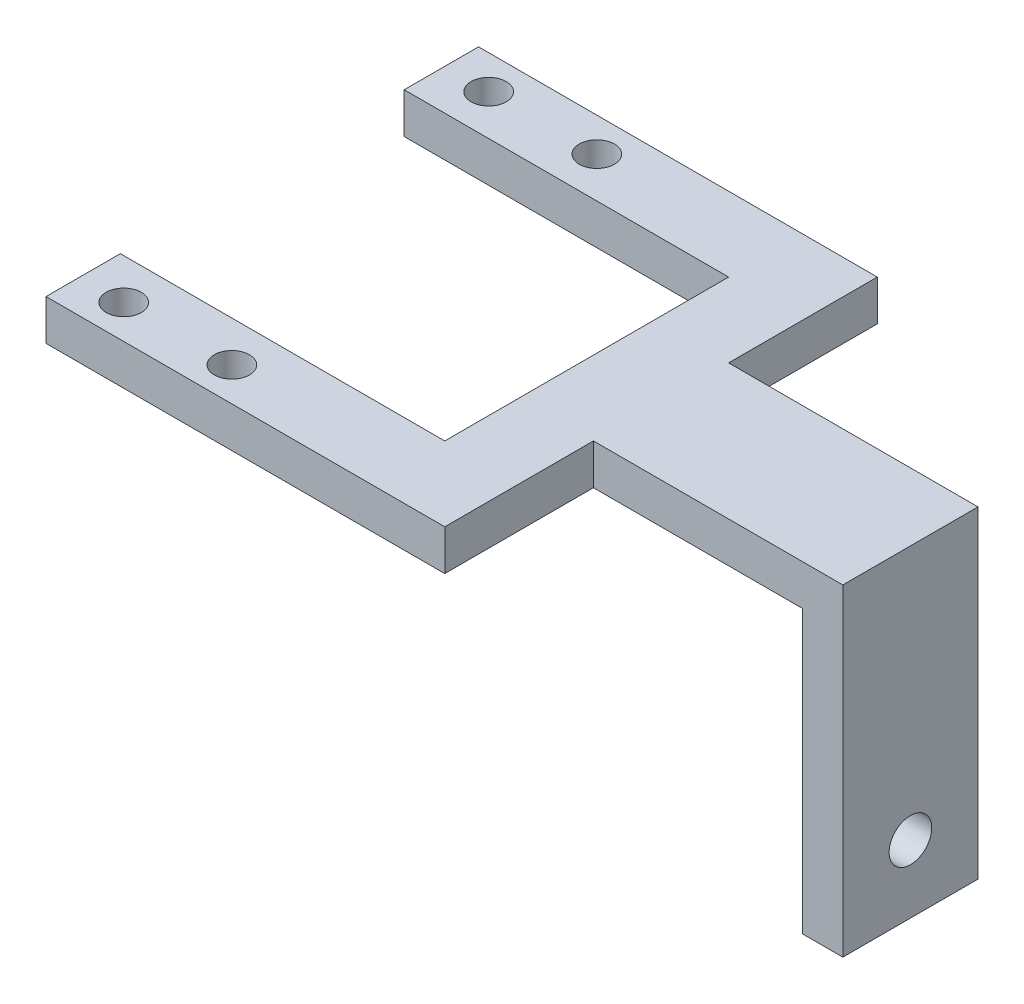
from build123d import *

# Parameters (mm, degrees)
SKETCH1_R           = 1.3
SKETCH1_W           = 3
SKETCH1_H           = 10
BOSS_EXTRUDE2_DEPTH = 3
SKETCH1_5_W         = 3
SKETCH1_5_H         = 10
BOSS_EXTRUDE3_DEPTH = 23.85
SKETCH4_R           = 1.575411087
CUT_EXTRUDE1_DEPTH  = 3


with BuildPart() as part:
    # Sketch1 → Boss-Extrude2 (new body)
    # profile 1 of 2: a face of its own
    with BuildSketch(Plane(origin=(0, 0, 0), x_dir=(1, 0, 0), z_dir=(0, 1, 0))):
        Polygon((-14.75, 16), (-14.75, 10.5), (9.25, 10.5), (9.25, -10.5), (-14.75, -10.5), (-14.75, -16), (14.75, -16), (14.75, -5), (30.2, -5), (30.2, 5), (14.75, 5), (14.75, 16), align=None)
        with Locations(Location((-11.5, -13.5, 0), (0, 0, 270))):
            Circle(SKETCH1_R, mode=Mode.SUBTRACT)
        with Locations(Location((-3.5, -13.5, 0), (0, 0, 270))):
            Circle(SKETCH1_R, mode=Mode.SUBTRACT)
        with Locations(Location((-11.5, 13.5, 0), (0, 0, 270))):
            Circle(SKETCH1_R, mode=Mode.SUBTRACT)
        with Locations(Location((-3.5, 13.5, 0), (0, 0, 270))):
            Circle(SKETCH1_R, mode=Mode.SUBTRACT)
    # profile 2 of 2: a face of its own
    with BuildSketch(Plane(origin=(0, 0, 0), x_dir=(1, 0, 0), z_dir=(0, 1, 0))):
        with Locations((31.7, 0)):
            Rectangle(SKETCH1_W, SKETCH1_H)
    extrude(amount=-BOSS_EXTRUDE2_DEPTH)

    # Sketch1<5> → Boss-Extrude3 (add)
    with BuildSketch(Plane(origin=(0, 0, 0), x_dir=(1, 0, 0), z_dir=(0, 1, 0))):
        with Locations((31.7, 0)):
            Rectangle(SKETCH1_5_W, SKETCH1_5_H)
    extrude(amount=-BOSS_EXTRUDE3_DEPTH)

    # Sketch4 → Cut-Extrude1 (cut)
    with BuildSketch(Plane.ZY.offset(-30.2)):
        with Locations((0, -18.85)):
            Circle(SKETCH4_R)
    extrude(amount=-CUT_EXTRUDE1_DEPTH, mode=Mode.SUBTRACT)


solid = part.part
